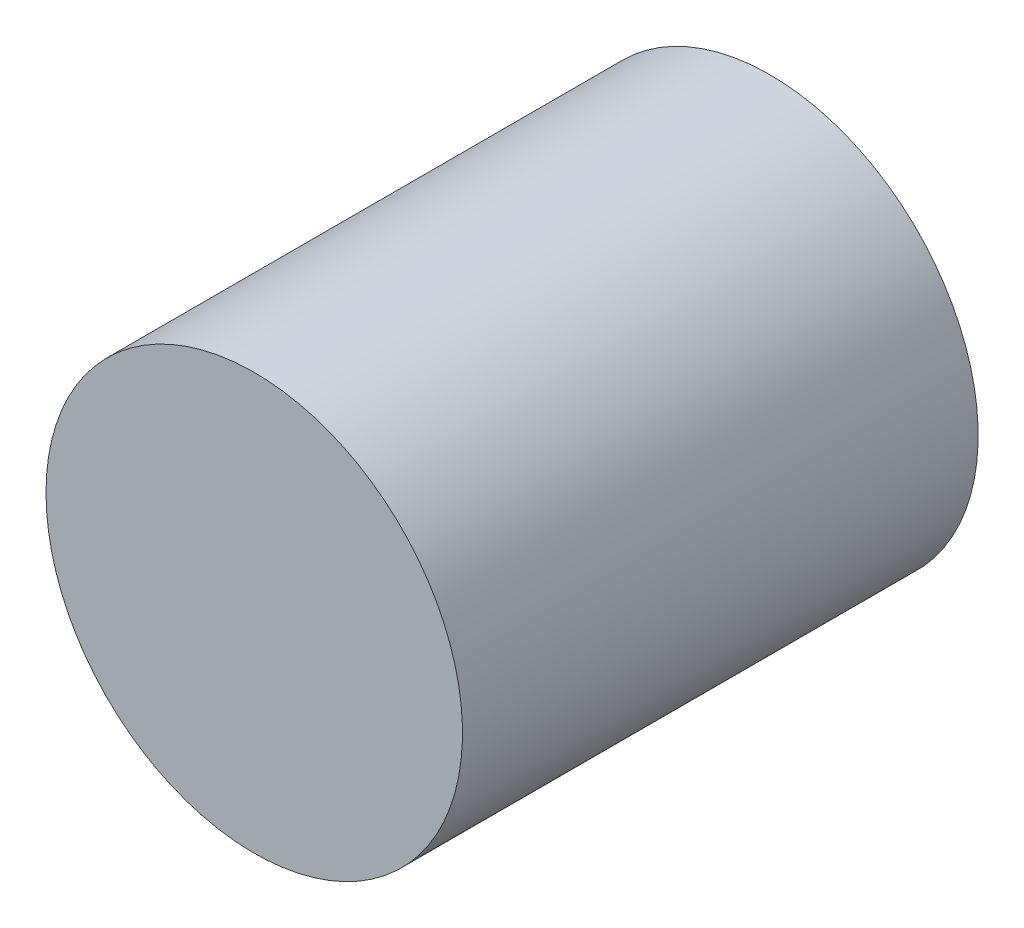
from build123d import *

# Parameters (mm, degrees)
SKETCH1_R           = 21
BOSS_EXTRUDE1_DEPTH = 52
SKETCH2_R           = 2
BOSS_EXTRUDE2_DEPTH = 2.5


with BuildPart() as part:
    # Sketch1 → Boss-Extrude1 (new body)
    with BuildSketch(Plane.XY):
        with Locations(Location((0, 0, 0), (0, 0, 180))):
            Circle(SKETCH1_R)
    extrude(amount=BOSS_EXTRUDE1_DEPTH)

    # Sketch2 → Boss-Extrude2 (add)
    with BuildSketch(Plane.XY):
        with Locations((0, 14.25)):
            Circle(SKETCH2_R)
        with Locations((12.340862004, -7.125)):
            Circle(SKETCH2_R)
        with Locations((-12.340862004, -7.125)):
            Circle(SKETCH2_R)
    extrude(amount=-BOSS_EXTRUDE2_DEPTH)


solid = part.part
